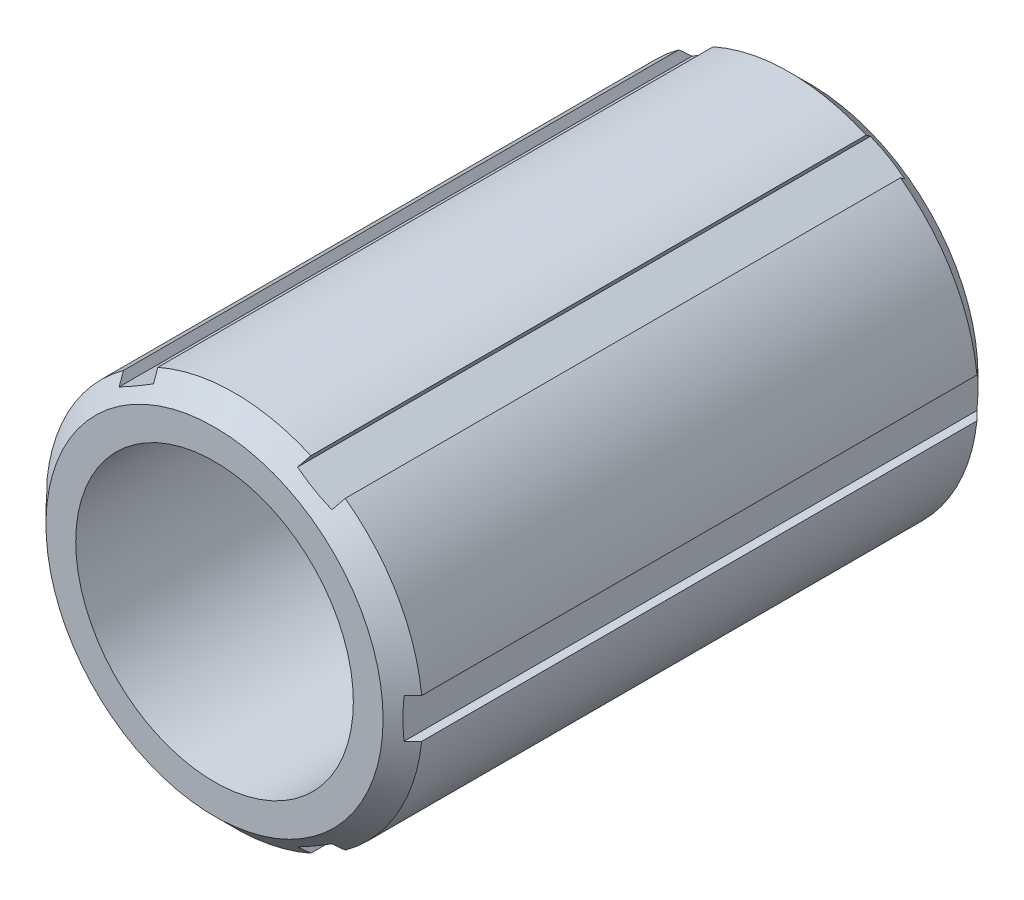
from build123d import *

# Parameters (mm, degrees)
SKETCH_1_R          = 9.5
SKETCH_1_R_2        = 7
EXTRUDE_1_DEPTH     = 30
CHAMFER_1_SIZE      = 1
SKETCH_2_W          = 1
SKETCH_2_H          = 2
CUT_EXTRUDE_1_DEPTH = 33.870959828


with BuildPart() as part:
    # 스케치1 → 보스-돌출1 (new body)
    with BuildSketch(Plane.XY):
        Circle(SKETCH_1_R)
        Circle(SKETCH_1_R_2, mode=Mode.SUBTRACT)
    extrude(amount=EXTRUDE_1_DEPTH)

    # 모따기1
    chamfer_1_edges = [part.edges().sort_by_distance(p)[0] for p in [
        (-9.5, 0, 0),
        (-9.5, 0, 30),
    ]]
    chamfer(chamfer_1_edges, length=CHAMFER_1_SIZE)

    # 스케치2 → 컷-돌출1 (cut, through all)
    with BuildSketch(Plane.XY):
        Polygon((-3.633974596, 8.294228634), (-5.366025404, 7.294228634), (-5.866025404, 8.160254038), (-4.133974596, 9.160254038), align=None)
        with Locations((-9.5, 0)):
            Rectangle(SKETCH_2_W, SKETCH_2_H)
        Polygon((5.366025404, 7.294228634), (3.633974596, 8.294228634), (4.133974596, 9.160254038), (5.866025404, 8.160254038), align=None)
        with Locations((9.5, 0)):
            Rectangle(SKETCH_2_W, SKETCH_2_H)
        Polygon((3.633974596, -8.294228634), (5.366025404, -7.294228634), (5.866025404, -8.160254038), (4.133974596, -9.160254038), align=None)
        Polygon((-5.366025404, -7.294228634), (-3.633974596, -8.294228634), (-4.133974596, -9.160254038), (-5.866025404, -8.160254038), align=None)
    extrude(amount=CUT_EXTRUDE_1_DEPTH, mode=Mode.SUBTRACT)


solid = part.part
